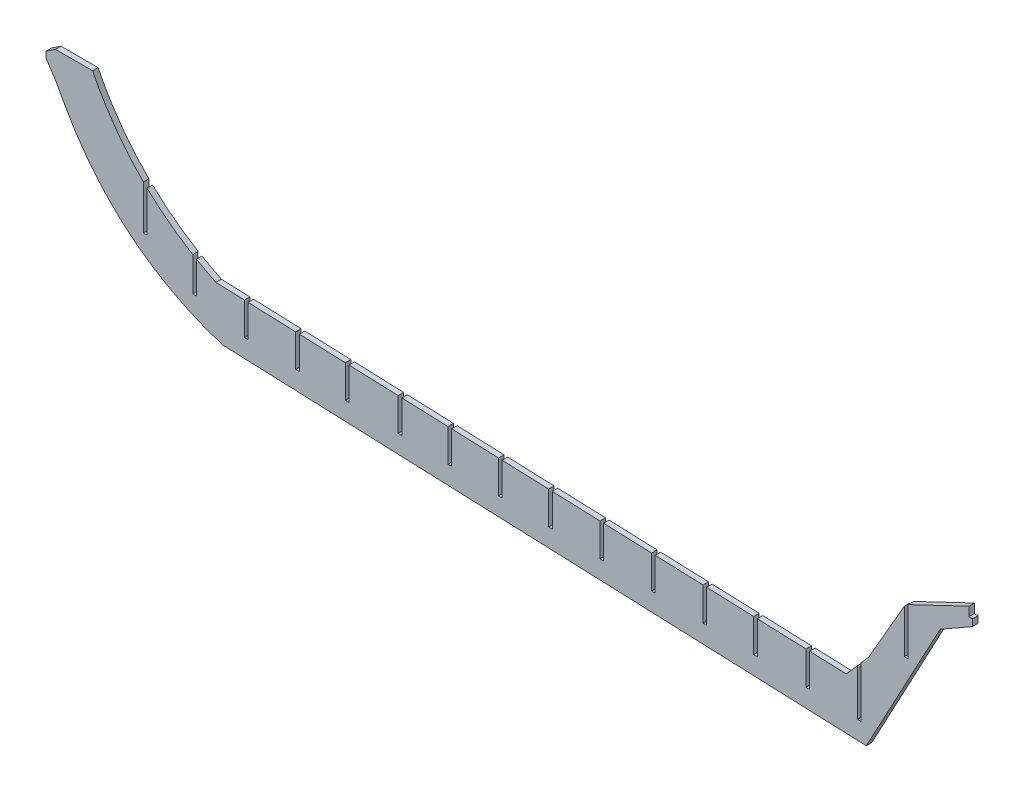
from build123d import *

# Parameters (mm, degrees)
BOSS_EXTRU_2_DEPTH      = 9
ENL_V_MAT_EXTRU_2_DEPTH = 9
ENL_V_MAT_EXTRU_3_DEPTH = 10


with BuildPart() as part:
    # Esquisse2 → Boss.-Extru.2 (new body)
    with BuildSketch(Plane.XY):
        with BuildLine():
            Line((0, 0), (-1054.629910096, 41.504522095))
            add(Edge.make_bspline(
                [(-1054.629910096, 41.504522095), (-1224.898895692, 94.973668649), (-1312.524127552, 251.32222999)],
                knots=[0, 0, 0, 1, 1, 1], degree=2))
            Line((-1312.524127552, 251.32222999), (-1328.531696794, 280.319102935))
            Line((-1328.531696794, 280.319102935), (-1344.106951464, 303.85903019))
            Line((-1344.106951464, 303.85903019), (-1344.106951464, 313.726103663))
            Line((-1344.106951464, 313.726103663), (-1328.531696794, 324.031511808))
            Line((-1328.531696794, 324.031511808), (-1267.786373333, 324.031511808))
            add(Edge.make_bspline(
                [(-1267.786373333, 324.031511808), (-1200.802691061, 189.858171363), (-1065.648891226, 124.819703679)],
                knots=[0, 0, 0, 1, 1, 1], degree=2))
            Line((-1065.648891226, 124.819703679), (-32.952008593, 85.506361999))
            Line((-32.952008593, 85.506361999), (3.920466967, 127.83912423))
            Line((3.920466967, 127.83912423), (64.215422919, 232.574312779))
            Line((64.215422919, 232.574312779), (174.034427263, 285.060674799))
            Line((174.034427263, 285.060674799), (174.034427263, 256.206685378))
            Line((174.034427263, 256.206685378), (121.088242371, 225.986251341))
            Line((121.088242371, 225.986251341), (0, 0))
        make_face()
    extrude(amount=BOSS_EXTRU_2_DEPTH)

    # Esquisse4 → Enlèv. mat.-Extru.2 (cut)
    with BuildSketch(Plane.XY.offset(9)):
        Polygon((-1184.529602798, 217.724215408), (-1184.529602798, 135.448257781), (-1178.529602798, 135.448257781), (-1178.529602798, 209.090265158), (-1144.70133954, 205.492785887), (-1103.644457427, 179.590935136), (-1103.644457427, 89.382882562), (-1097.644457427, 89.382882562), (-1097.644457427, 179.446129165), (-1058.771084869, 193.19166203), (-1019.010707999, 166.029669526), (-1019.010707999, 69.825141164), (-1013.010707999, 69.825141164), (-1013.010707999, 171.757290266), (-976.159938867, 178.961810764), (-935.048554391, 165.659851123), (-935.048554391, 66.613746424), (-929.048554391, 66.613746424), (-929.048554391, 168.626007321), (-899.191490776, 176.533293355), (-853.677357938, 164.630819251), (-853.677357938, 63.31851584), (-847.677357938, 63.31851584), (-847.677357938, 162.817540503), (-811.471381442, 172.717047921), (-767.007980127, 153.902087887), (-767.007980127, 59.907678473), (-761.007980127, 59.907678473), (-761.007980127, 158.835177903), (-728.976717682, 166.128230874), (-685.459139962, 147.713501876), (-685.459139962, 56.698357737), (-679.459139962, 56.698357737), (-679.459139962, 154.327101163), (-649.905537681, 165.9958335), (-602.536147946, 145.951186705), (-602.536147946, 53.434957827), (-596.536147946, 53.434957827), (-596.536147946, 161.072273499), (-555.59381923, 172.649077058), (-520.486290487, 157.793111688), (-520.486290487, 50.205919764), (-514.486290487, 50.205919764), (-514.486290487, 160.41177098), (-480.664688329, 172.846379378), (-436.427460908, 161.277830864), (-436.427460908, 46.897819438), (-430.427460908, 46.897819438), (-430.427460908, 158.641730929), (-395.32870164, 170.633772463), (-351.840812464, 156.56287327), (-351.840812464, 43.56894702), (-345.840812464, 43.56894702), (-345.840812464, 155.107643224), (-308.077421895, 166.28633821), (-267.638115004, 149.174198328), (-267.638115004, 40.255184833), (-261.638115004, 40.255184833), (-261.638115004, 153.983543807), (-221.709640224, 161.11753493), (-184.626054736, 149.118806019), (-184.626054736, 36.988279678), (-178.626054736, 36.988279678), (-178.626054736, 151.239542378), (-139.271820507, 168.536058377), (-98.813045081, 157.955618923), (-98.813045081, 33.611144324), (-92.813045081, 33.611144324), (-92.813045081, 160.511283345), (-14.555231491, 166.695289229), (-14.555231491, 30.295213064), (-8.555231491, 30.295213064), (-8.555231491, 161.111803569), (0.41457384, 188.834118596), (62.357322712, 238.773502267), (62.357322712, 157.574856228), (68.357322712, 157.574856228), (68.357322712, 244.567559026), (-1159.810752478, 244.345562012), align=None)
    extrude(amount=-ENL_V_MAT_EXTRU_2_DEPTH, mode=Mode.SUBTRACT)

    # Esquisse5 → Enlèv. mat.-Extru.3 (cut)
    with BuildSketch(Plane.XY.offset(9)):
        Polygon((168.034427263, 282.193063915), (168.034427263, 267.193063915), (174.034427263, 267.193063915), (199.390837842, 261.800934677), (195.304614358, 289.974370277), (176.522323958, 289.61592962), align=None)
    extrude(amount=-ENL_V_MAT_EXTRU_3_DEPTH, mode=Mode.SUBTRACT)


solid = part.part
